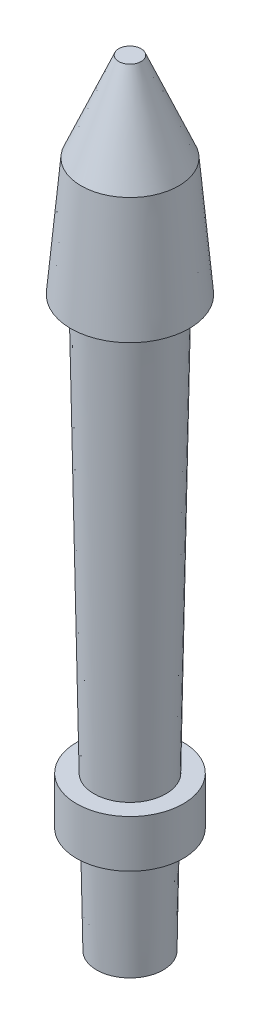
from build123d import *

# Parameters (mm, degrees)
SKETCH1_R                     = 9
SKETCH1_R_2                   = 6.075
BOSS_EXTRUDE1_DEPTH           = 8
SKETCH1_2_R                   = 6.075
BOSS_EXTRUDE2_DEPTH           = 70
BOSS_EXTRUDE2_TAPER           = -1
BOSS_EXTRUDE2_OTHER_WAY_DEPTH = 26
BOSS_EXTRUDE2_OTHER_WAY_TAPER = 1
SKETCH4_R                     = 10
BOSS_EXTRUDE3_DEPTH           = 20
BOSS_EXTRUDE3_TAPER           = 5
SKETCH5_R                     = 8.250226729
BOSS_EXTRUDE4_DEPTH           = 15
BOSS_EXTRUDE4_TAPER           = 23


with BuildPart() as part:
    # Sketch1 → Boss-Extrude1 (new body)
    with BuildSketch(Plane(origin=(0, 0, 0), x_dir=(1, 0, 0), z_dir=(0, 1, 0))):
        with Locations(Location((0, 0, 0), (0, 0, 270))):
            Circle(SKETCH1_R)
        with Locations(Location((0, 0, 0), (0, 0, 270))):
            Circle(SKETCH1_R_2, mode=Mode.SUBTRACT)
    extrude(amount=-BOSS_EXTRUDE1_DEPTH)



with BuildPart() as body_2:
    # Sketch1<2> → Boss-Extrude2 (new body)
    with BuildSketch(Plane(origin=(0, 0, 0), x_dir=(1, 0, 0), z_dir=(0, 1, 0))):
        with Locations(Location((0, 0, 0), (0, 0, 270))):
            Circle(SKETCH1_2_R)
    extrude(amount=BOSS_EXTRUDE2_DEPTH, taper=BOSS_EXTRUDE2_TAPER)


with BuildPart() as part_1:
    add(part.part)

    add(body_2.part)  # Boss-Extrude2 other way merges body 2
    # Sketch1<2> → Boss-Extrude2 other way (add)
    with BuildSketch(Plane(origin=(0, 0, 0), x_dir=(1, 0, 0), z_dir=(0, 1, 0))):
        with Locations(Location((0, 0, 0), (0, 0, 270))):
            Circle(SKETCH1_2_R)
    extrude(amount=-BOSS_EXTRUDE2_OTHER_WAY_DEPTH, taper=BOSS_EXTRUDE2_OTHER_WAY_TAPER)

    # Sketch4 → Boss-Extrude3 (add)
    with BuildSketch(Plane(origin=(0, 70, 0), x_dir=(1, 0, 0), z_dir=(0, 1, 0))):
        Circle(SKETCH4_R)
    extrude(amount=BOSS_EXTRUDE3_DEPTH, taper=BOSS_EXTRUDE3_TAPER)

    # Sketch5 → Boss-Extrude4 (add)
    with BuildSketch(Plane(origin=(0, 90, 0), x_dir=(1, 0, 0), z_dir=(0, 1, 0))):
        Circle(SKETCH5_R)
    extrude(amount=BOSS_EXTRUDE4_DEPTH, taper=BOSS_EXTRUDE4_TAPER)


solid = part_1.part
